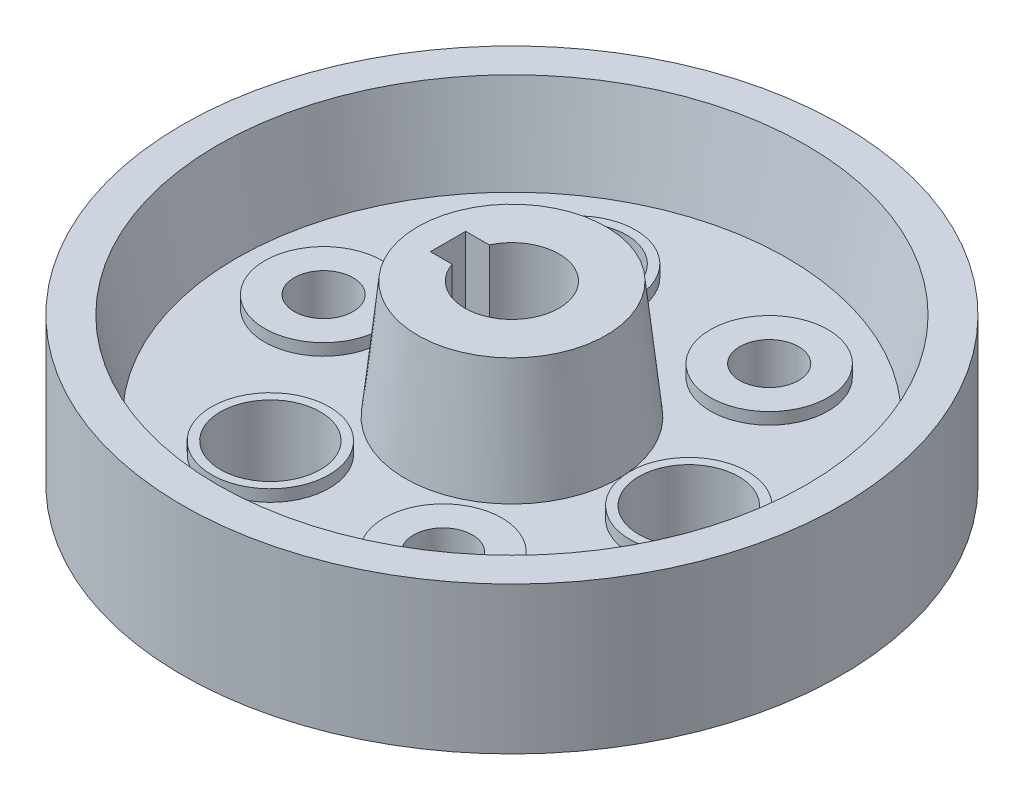
from build123d import *

# Parameters (mm, degrees)
ESBO_O2_R                = 5
CORTE_EXTRUS_O2_DEPTH    = 30
PADR_OCIRCULAR1_COUNT    = 3
ESBO_O6_R                = 6
CORTE_EXTRUS_O5_DEPTH    = 2
PADR_OCIRCULAR4_COUNT    = 3
ESBO_O9_W                = 3.998230439
ESBO_O9_H                = 6
CORTE_EXTRUS_O6_DEPTH    = 129.763348823
ESBO_O10_R               = 8.5
CORTE_EXTRUS_O7_DEPTH    = 10
PADR_OCIRCULAR5_COUNT    = 3
ESBO_O11_R               = 10
RESSALTO_EXTRUS_O1_DEPTH = 2
CORTE_EXTRUS_O9_START    = 2
ESBO_O12_R               = 8.5
CORTE_EXTRUS_O9_DEPTH    = 2
RESSALTO_EXTRUS_O2_START = 2
ESBO_O13_R               = 10
ESBO_O13_R_2             = 5
RESSALTO_EXTRUS_O2_DEPTH = 2
PADR_OCIRCULAR6_COUNT    = 3
ESBO_O14_R               = 17.5
CORTE_EXTRUS_O10_DEPTH   = 3


with BuildPart() as part:
    # Esboço1 → Revolução1 (revolve)
    with BuildSketch(Plane.XY):
        Polygon((0, 0), (48, 0), (48, 30), (40, 30), (37.866686426, 10), (32.866686426, 10), (14.223529412, 10), (9.223529412, 10), (6, 25), (0, 25), align=None)
    revolve(axis=Axis((56, 30, 0), (0, -1, 0)))

    # Esboço2 → Corte-extrusão2 (cut)
    with BuildSketch(Plane(origin=(0, 10, 0), x_dir=(1, 0, 0), z_dir=(0, 1, 0))):
        with Locations(Location((24, 0, 0), (0, 0, 180))):
            Circle(ESBO_O2_R)
    corte_extrus_o2 = extrude(amount=-CORTE_EXTRUS_O2_DEPTH, mode=Mode.SUBTRACT)

    # PadrãoCircular1: Corte-extrusão2 ×3 about axis
    padr_ocircular1_axis = Axis((56, 0, 0), (0, 1, 0))
    for i in range(1, PADR_OCIRCULAR1_COUNT):
        add(corte_extrus_o2.rotate(padr_ocircular1_axis, i * 360 / PADR_OCIRCULAR1_COUNT), mode=Mode.SUBTRACT)

    # Esboço6 → Corte-extrusão5 (cut)
    with BuildSketch(Plane.XZ):
        with Locations((24, 0)):
            Circle(ESBO_O6_R)
    corte_extrus_o5 = extrude(amount=-CORTE_EXTRUS_O5_DEPTH, mode=Mode.SUBTRACT)

    # PadrãoCircular4: Corte-extrusão5 ×3 about axis
    padr_ocircular4_axis = Axis((56, 0, 0), (0, 1, 0))
    for i in range(1, PADR_OCIRCULAR4_COUNT):
        add(corte_extrus_o5.rotate(padr_ocircular4_axis, i * 360 / PADR_OCIRCULAR4_COUNT), mode=Mode.SUBTRACT)

    # Esboço9 → Corte-extrusão6 (cut, through all)
    with BuildSketch(Plane(origin=(0, 30, 0), x_dir=(1, 0, 0), z_dir=(0, 1, 0))):
        with Locations((46.755362969, 0.391520848)):
            Rectangle(ESBO_O9_W, ESBO_O9_H)
    extrude(amount=-CORTE_EXTRUS_O6_DEPTH, mode=Mode.SUBTRACT)

    # Esboço10 → Corte-extrusão7 (cut)
    with BuildSketch(Plane(origin=(0, 10, 0), x_dir=(1, 0, 0), z_dir=(0, 1, 0))):
        with Locations(Location((40.977280539, 26.020113375, 0), (0, 0, 180))):
            Circle(ESBO_O10_R)
    corte_extrus_o7 = extrude(amount=-CORTE_EXTRUS_O7_DEPTH, mode=Mode.SUBTRACT)

    # PadrãoCircular5: Corte-extrusão7 ×3 about axis
    padr_ocircular5_axis = Axis((56, 0, 0), (0, 1, 0))
    for i in range(1, PADR_OCIRCULAR5_COUNT):
        add(corte_extrus_o7.rotate(padr_ocircular5_axis, i * 360 / PADR_OCIRCULAR5_COUNT), mode=Mode.SUBTRACT)

    # Esboço11 → Ressalto-extrusão1 (add)
    with BuildSketch(Plane(origin=(0, 10, 0), x_dir=(1, 0, 0), z_dir=(0, 1, 0))):
        with Locations(Location((40.977280539, 26.020113375, 0), (0, 0, 180))):
            Circle(ESBO_O11_R)
        with Locations(Location((86.045438923, 0, 0), (0, 0, 180))):
            Circle(ESBO_O11_R)
        with Locations(Location((40.977280539, -26.020113375, 0), (0, 0, 180))):
            Circle(ESBO_O11_R)
    extrude(amount=RESSALTO_EXTRUS_O1_DEPTH)

    # Esboço12 → Corte-extrusão9 (cut)
    with BuildSketch(Plane(origin=(0, 10, 0), x_dir=(1, 0, 0), z_dir=(0, 1, 0)).offset(CORTE_EXTRUS_O9_START)):
        with Locations(Location((40.977280539, 26.020113375, 0), (0, 0, 180))):
            Circle(ESBO_O12_R)
        with Locations(Location((40.977280539, -26.020113375, 0), (0, 0, 180))):
            Circle(ESBO_O12_R)
        with Locations(Location((86.045438923, 0, 0), (0, 0, 180))):
            Circle(ESBO_O12_R)
    extrude(amount=-CORTE_EXTRUS_O9_DEPTH, mode=Mode.SUBTRACT)

    # Esboço13 → Ressalto-extrusão2 (add)
    with BuildSketch(Plane(origin=(0, 10, 0), x_dir=(1, 0, 0), z_dir=(0, 1, 0)).offset(RESSALTO_EXTRUS_O2_START)):
        with Locations(Location((24, 0, 0), (0, 0, 180))):
            Circle(ESBO_O13_R)
        with Locations(Location((24, 0, 0), (0, 0, 180))):
            Circle(ESBO_O13_R_2, mode=Mode.SUBTRACT)
    ressalto_extrus_o2 = extrude(amount=-RESSALTO_EXTRUS_O2_DEPTH)

    # PadrãoCircular6: Corte-extrusão2, Ressalto-extrusão2 ×3 about axis
    padr_ocircular6_axis = Axis((56, 0, 0), (0, 1, 0))
    add([corte_extrus_o2.rotate(padr_ocircular6_axis, i * 360 / PADR_OCIRCULAR6_COUNT) for i in range(1, PADR_OCIRCULAR6_COUNT)], mode=Mode.SUBTRACT)
    add([ressalto_extrus_o2.rotate(padr_ocircular6_axis, i * 360 / PADR_OCIRCULAR6_COUNT) for i in range(1, PADR_OCIRCULAR6_COUNT)])

    # Esboço14 → Corte-extrusão10 (cut)
    with BuildSketch(Plane.XZ):
        with Locations((56, 0)):
            Circle(ESBO_O14_R)
    extrude(amount=-CORTE_EXTRUS_O10_DEPTH, mode=Mode.SUBTRACT)


solid = part.part
